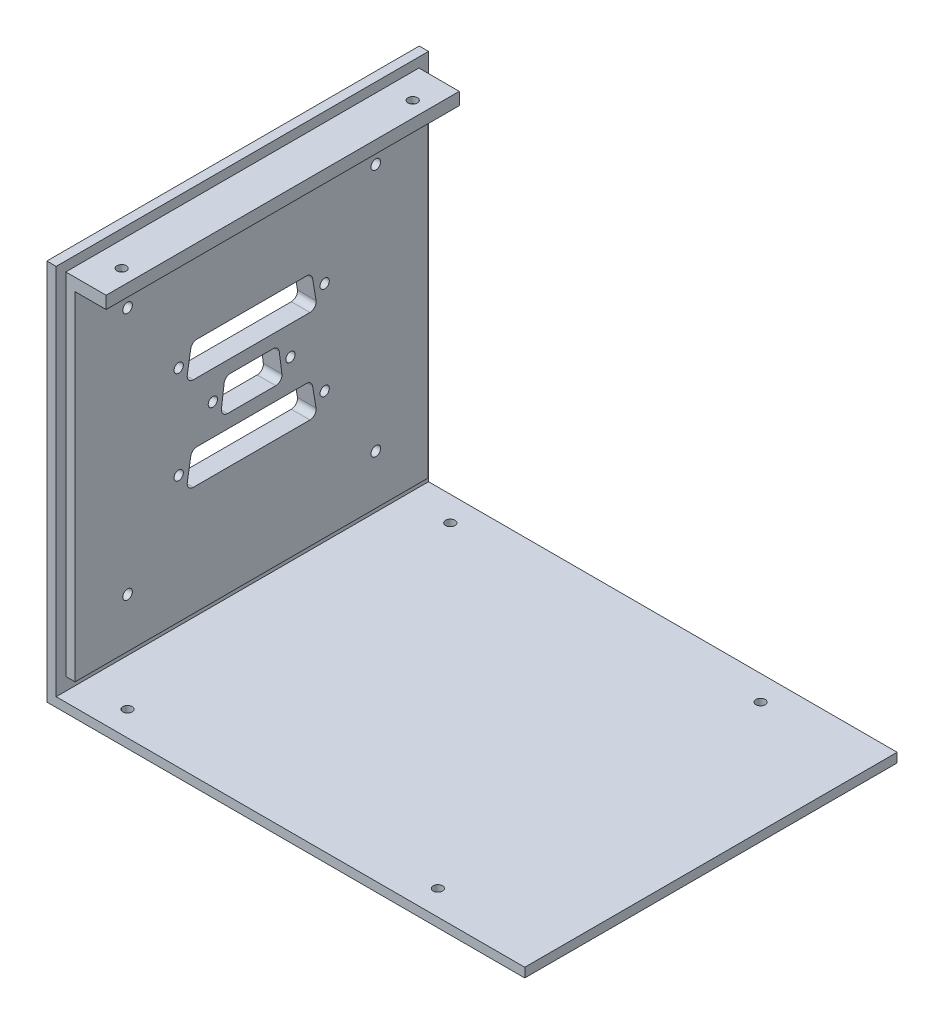
from build123d import *

# Parameters (mm, degrees)
SKETCH1_W              = 154
SKETCH1_H              = 120
LARGE_WALL_OUTER_DEPTH = 3
SKETCH8_W              = 3
SKETCH8_H              = 120
SMALL_WALL_OUTER_DEPTH = 120.1
SKETCH10_W             = 113.8
SKETCH10_H             = 112.9
SMALL_WALL_INNER_DEPTH = 3
SKETCH14_W             = 113.8
SKETCH14_H             = 4
MOUNT_DEPTH            = 10
MOUNTING_NUTS_DEPTH    = 2
NUT_1_BOLT_HOLE_REACH  = 155.144
SKETCH18_R             = 1.5
NUT_2_BOLT_HOLE_REACH  = 155.144
SKETCH19_R             = 1.5
CONNECTOR_SLOTS_REACH  = 208.082
SKETCH23_R             = 1.5
SKETCH27_R             = 1.55
SKETCH27_R_2           = 1.5
PCB_MOUNT_HOLES_DEPTH  = 6
SKETCH28_R             = 1.5
BOLT_HOLE1_DEPTH       = 10
SKETCH29_R             = 1.5
BOLT_HOLE2_DEPTH       = 10
SKETCH30_R             = 1.5
BOLT_HOLES34_DEPTH     = 10


with BuildPart() as part:
    # Sketch1 → Large-Wall-Outer (new body)
    with BuildSketch(Plane(origin=(0, 0, 0), x_dir=(1, 0, 0), z_dir=(0, 1, 0))):
        Rectangle(SKETCH1_W, SKETCH1_H)
    extrude(amount=LARGE_WALL_OUTER_DEPTH)

    # Sketch8 → Small-Wall-Outer (add)
    with BuildSketch(Plane(origin=(0, 3, 0), x_dir=(1, 0, 0), z_dir=(0, 1, 0))):
        with Locations((-75.5, 0)):
            Rectangle(SKETCH8_W, SKETCH8_H)
    extrude(amount=SMALL_WALL_OUTER_DEPTH)

    # Sketch10 → Small-Wall-Inner (add)
    with BuildSketch(Plane(origin=(-74, 0, 0), x_dir=(0, 0, -1), z_dir=(1, 0, 0))):
        with Locations((0, 63.55)):
            Rectangle(SKETCH10_W, SKETCH10_H)
    extrude(amount=SMALL_WALL_INNER_DEPTH)

    # Sketch14 → Mount (add)
    with BuildSketch(Plane(origin=(-71, 0, 0), x_dir=(0, 0, -1), z_dir=(1, 0, 0))):
        with Locations((0, 118)):
            Rectangle(SKETCH14_W, SKETCH14_H)
    extrude(amount=MOUNT_DEPTH)

    # Sketch17 → Mounting-Nuts (cut)
    with BuildSketch(Plane.XZ.offset(-116)):
        Polygon((-66, 43.7), (-63.228718708, 45.3), (-63.228718708, 48.5), (-66, 50.1), (-68.771281292, 48.5), (-68.771281292, 45.3), align=None)
        Polygon((-66, -50.1), (-63.228718708, -48.5), (-63.228718708, -45.3), (-66, -43.7), (-68.771281292, -45.3), (-68.771281292, -48.5), align=None)
    extrude(amount=-MOUNTING_NUTS_DEPTH, mode=Mode.SUBTRACT)

    # Sketch18 → Nut-1-Bolt-Hole (cut, up to next)
    with BuildSketch(Plane.XZ.offset(-118), mode=Mode.PRIVATE) as nut_1_bolt_hole_sk1:
        with Locations(Location((-66, 46.9, 0), (0, 0, 270))):
            Circle(SKETCH18_R)
    nut_1_bolt_hole_tool1 = extrude(nut_1_bolt_hole_sk1.sketch, amount=-NUT_1_BOLT_HOLE_REACH, mode=Mode.PRIVATE) & part.part
    add(nut_1_bolt_hole_tool1.solids().sort_by_distance((-66, 118, 46.9))[0], mode=Mode.SUBTRACT)

    # Sketch19 → Nut-2-Bolt-Hole (cut, up to next)
    with BuildSketch(Plane.XZ.offset(-118), mode=Mode.PRIVATE) as nut_2_bolt_hole_sk1:
        with Locations(Location((-66, -46.9, 0), (0, 0, 270))):
            Circle(SKETCH19_R)
    nut_2_bolt_hole_tool1 = extrude(nut_2_bolt_hole_sk1.sketch, amount=-NUT_2_BOLT_HOLE_REACH, mode=Mode.PRIVATE) & part.part
    add(nut_2_bolt_hole_tool1.solids().sort_by_distance((-66, 118, -46.9))[0], mode=Mode.SUBTRACT)

    # Sketch23 → Connector-Slots (cut, up to next)
    with BuildSketch(Plane(origin=(-77, 0, 0), x_dir=(0, 0, -1), z_dir=(-1, 0, 0)), mode=Mode.PRIVATE) as connector_slots_sk1:
        with Locations(Location((-12.5, -63.05, 0), (0, 0, 180))):
            Circle(SKETCH23_R)
    connector_slots_tool1 = extrude(connector_slots_sk1.sketch, amount=-CONNECTOR_SLOTS_REACH, mode=Mode.PRIVATE) & part.part
    # Sketch23 → Connector-Slots (cut, up to next)
    with BuildSketch(Plane(origin=(-77, 0, 0), x_dir=(0, 0, -1), z_dir=(-1, 0, 0)), mode=Mode.PRIVATE) as connector_slots_sk2:
        with Locations(Location((12.5, -63.05, 0), (0, 0, 180))):
            Circle(SKETCH23_R)
    connector_slots_tool2 = extrude(connector_slots_sk2.sketch, amount=-CONNECTOR_SLOTS_REACH, mode=Mode.PRIVATE) & part.part
    # Sketch23 → Connector-Slots (cut, up to next)
    with BuildSketch(Plane(origin=(-77, 0, 0), x_dir=(0, 0, -1), z_dir=(-1, 0, 0)), mode=Mode.PRIVATE) as connector_slots_sk3:
        with Locations(Location((-23.52, -78.05, 0), (0, 0, 180))):
            Circle(SKETCH23_R)
    connector_slots_tool3 = extrude(connector_slots_sk3.sketch, amount=-CONNECTOR_SLOTS_REACH, mode=Mode.PRIVATE) & part.part
    # Sketch23 → Connector-Slots (cut, up to next)
    with BuildSketch(Plane(origin=(-77, 0, 0), x_dir=(0, 0, -1), z_dir=(-1, 0, 0)), mode=Mode.PRIVATE) as connector_slots_sk4:
        with Locations(Location((23.52, -78.05, 0), (0, 0, 180))):
            Circle(SKETCH23_R)
    connector_slots_tool4 = extrude(connector_slots_sk4.sketch, amount=-CONNECTOR_SLOTS_REACH, mode=Mode.PRIVATE) & part.part
    # Sketch23 → Connector-Slots (cut, up to next)
    with BuildSketch(Plane(origin=(-77, 0, 0), x_dir=(0, 0, -1), z_dir=(-1, 0, 0)), mode=Mode.PRIVATE) as connector_slots_sk5:
        with Locations(Location((-23.52, -48.05, 0), (0, 0, 180))):
            Circle(SKETCH23_R)
    connector_slots_tool5 = extrude(connector_slots_sk5.sketch, amount=-CONNECTOR_SLOTS_REACH, mode=Mode.PRIVATE) & part.part
    # Sketch23 → Connector-Slots (cut, up to next)
    with BuildSketch(Plane(origin=(-77, 0, 0), x_dir=(0, 0, -1), z_dir=(-1, 0, 0)), mode=Mode.PRIVATE) as connector_slots_sk6:
        with Locations(Location((23.52, -48.05, 0), (0, 0, 180))):
            Circle(SKETCH23_R)
    connector_slots_tool6 = extrude(connector_slots_sk6.sketch, amount=-CONNECTOR_SLOTS_REACH, mode=Mode.PRIVATE) & part.part
    # Sketch23 → Connector-Slots (cut, up to next)
    with BuildSketch(Plane(origin=(-77, 0, 0), x_dir=(0, 0, -1), z_dir=(-1, 0, 0)), mode=Mode.PRIVATE) as connector_slots_sk7:
        with BuildLine():
            Line((-6.891594987, -68.167891943), (6.891594987, -68.167891943))
            ThreePointArc((6.891594987, -68.167891943), (8.211781315, -67.670259427), (8.875, -66.425))
            Line((8.875, -66.425), (9.75, -59.675))
            ThreePointArc((9.75, -59.675), (9.268962471, -58.097705614), (7.766594987, -57.417891943))
            Line((7.766594987, -57.417891943), (-7.766594987, -57.417891943))
            ThreePointArc((-7.766594987, -57.417891943), (-9.268962471, -58.097705614), (-9.75, -59.675))
            Line((-9.75, -59.675), (-8.875, -66.425))
            ThreePointArc((-8.875, -66.425), (-8.211781315, -67.670259427), (-6.891594987, -68.167891943))
        make_face()
    connector_slots_tool7 = extrude(connector_slots_sk7.sketch, amount=-CONNECTOR_SLOTS_REACH, mode=Mode.PRIVATE) & part.part
    # Sketch23 → Connector-Slots (cut, up to next)
    with BuildSketch(Plane(origin=(-77, 0, 0), x_dir=(0, 0, -1), z_dir=(-1, 0, 0)), mode=Mode.PRIVATE) as connector_slots_sk8:
        with BuildLine():
            Line((-17.652212152, -83.096202025), (17.652212152, -83.096202025))
            ThreePointArc((17.652212152, -83.096202025), (18.944961945, -82.62224199), (19.625, -81.425))
            Line((19.625, -81.425), (20.75, -74.675))
            ThreePointArc((20.75, -74.675), (20.303252117, -73.053452233), (18.777212152, -72.346202025))
            Line((18.777212152, -72.346202025), (-18.777212152, -72.346202025))
            ThreePointArc((-18.777212152, -72.346202025), (-20.303252117, -73.053452233), (-20.75, -74.675))
            Line((-20.75, -74.675), (-19.625, -81.425))
            ThreePointArc((-19.625, -81.425), (-18.944961945, -82.62224199), (-17.652212152, -83.096202025))
        make_face()
    connector_slots_tool8 = extrude(connector_slots_sk8.sketch, amount=-CONNECTOR_SLOTS_REACH, mode=Mode.PRIVATE) & part.part
    # Sketch23 → Connector-Slots (cut, up to next)
    with BuildSketch(Plane(origin=(-77, 0, 0), x_dir=(0, 0, -1), z_dir=(-1, 0, 0)), mode=Mode.PRIVATE) as connector_slots_sk9:
        with BuildLine():
            Line((-17.652212152, -53.096202025), (17.652212152, -53.096202025))
            ThreePointArc((17.652212152, -53.096202025), (18.944961945, -52.62224199), (19.625, -51.425))
            Line((19.625, -51.425), (20.75, -44.675))
            ThreePointArc((20.75, -44.675), (20.303252117, -43.053452233), (18.777212152, -42.346202025))
            Line((18.777212152, -42.346202025), (-18.777212152, -42.346202025))
            ThreePointArc((-18.777212152, -42.346202025), (-20.303252117, -43.053452233), (-20.75, -44.675))
            Line((-20.75, -44.675), (-19.625, -51.425))
            ThreePointArc((-19.625, -51.425), (-18.944961945, -52.62224199), (-17.652212152, -53.096202025))
        make_face()
    connector_slots_tool9 = extrude(connector_slots_sk9.sketch, amount=-CONNECTOR_SLOTS_REACH, mode=Mode.PRIVATE) & part.part
    add(connector_slots_tool1.solids().sort_by_distance((-77, 63.05, 12.5))[0], mode=Mode.SUBTRACT)
    add(connector_slots_tool2.solids().sort_by_distance((-77, 63.05, -12.5))[0], mode=Mode.SUBTRACT)
    add(connector_slots_tool3.solids().sort_by_distance((-77, 78.05, 23.52))[0], mode=Mode.SUBTRACT)
    add(connector_slots_tool4.solids().sort_by_distance((-77, 78.05, -23.52))[0], mode=Mode.SUBTRACT)
    add(connector_slots_tool5.solids().sort_by_distance((-77, 48.05, 23.52))[0], mode=Mode.SUBTRACT)
    add(connector_slots_tool6.solids().sort_by_distance((-77, 48.05, -23.52))[0], mode=Mode.SUBTRACT)
    add(connector_slots_tool7.solids().sort_by_distance((-77, 62.681741, 0))[0], mode=Mode.SUBTRACT)
    add(connector_slots_tool8.solids().sort_by_distance((-77, 77.655881, 0))[0], mode=Mode.SUBTRACT)
    add(connector_slots_tool9.solids().sort_by_distance((-77, 47.655881, 0))[0], mode=Mode.SUBTRACT)

    # Sketch27 → PCB-Mount-Holes (cut)
    with BuildSketch(Plane.ZY.offset(77)):
        with Locations((-40, 23.05)):
            Circle(SKETCH27_R)
        with Locations((12.5, 63.05)):
            Circle(SKETCH27_R_2)
        with Locations((-12.5, 63.05)):
            Circle(SKETCH27_R_2)
        with Locations((40, 23.05)):
            Circle(SKETCH27_R)
        with Locations((40, 103.05)):
            Circle(SKETCH27_R)
        with Locations((-40, 103.05)):
            Circle(SKETCH27_R)
    extrude(amount=-PCB_MOUNT_HOLES_DEPTH, mode=Mode.SUBTRACT)

    # Sketch28 → bolt-hole1 (cut)
    with BuildSketch(Plane(origin=(0, 3, 0), x_dir=(1, 0, 0), z_dir=(0, 1, 0))):
        with Locations(Location((-59, -52, 0), (0, 0, 270))):
            Circle(SKETCH28_R)
    extrude(amount=-BOLT_HOLE1_DEPTH, mode=Mode.SUBTRACT)

    # Sketch29 → bolt-hole2 (cut)
    with BuildSketch(Plane(origin=(0, 0, 0), x_dir=(-1, 0, 0), z_dir=(0, -1, 0))):
        with Locations(Location((-41, -52, 0), (0, 0, 90))):
            Circle(SKETCH29_R)
    extrude(amount=-BOLT_HOLE2_DEPTH, mode=Mode.SUBTRACT)

    # Sketch30 → bolt-holes34 (cut)
    with BuildSketch(Plane.XZ):
        with Locations(Location((-59, -52, 0), (0, 0, 270))):
            Circle(SKETCH30_R)
        with Locations(Location((41, -52, 0), (0, 0, 270))):
            Circle(SKETCH30_R)
    extrude(amount=-BOLT_HOLES34_DEPTH, mode=Mode.SUBTRACT)


solid = part.part
